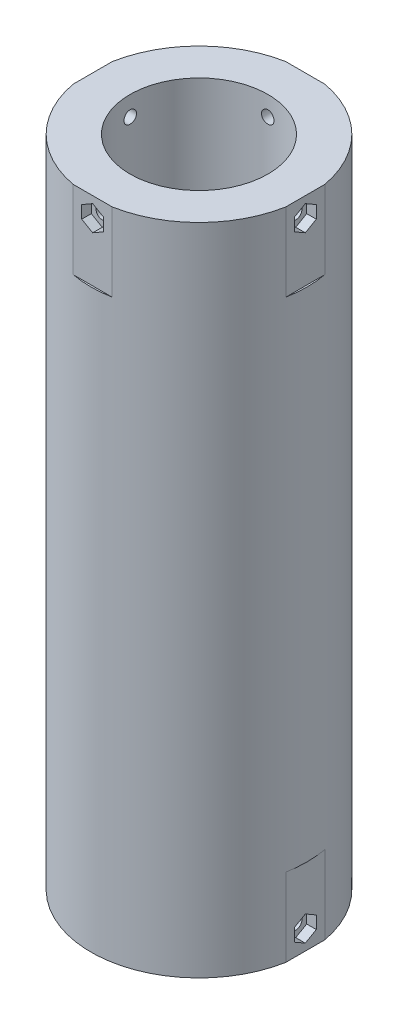
from build123d import *

# Parameters (mm, degrees)
SKETCH_1_R               = 27.65
SKETCH_1_R_2             = 17.65
EXTRUDE_1_DEPTH          = 167.37
CUT_EXTRUDE_1_DEPTH      = 20
CUT_EXTRUDE_START        = 147.37
CUT_EXTRUDE_2_DEPTH      = 20
CUT_EXTRUDE_4_DEPTH      = 26
CUT_EXTRUDE_4_DEPTH_BACK = 26
SKETCH_5_R               = 1.6
CUT_EXTRUDE_START_2      = 27.194163
CUT_EXTRUDE_3_DEPTH      = 2.45
CUT_EXTRUDE_5_DEPTH      = 2.45
CUT_EXTRUDE_START_3      = 27.2
CUT_EXTRUDE_6_DEPTH      = 2.45
PATTERN_CIRCULAR_2_COUNT = 4
SKETCH_8_R               = 1.6
CUT_EXTRUDE_7_DEPTH      = 32.4
PATTERN_CIRCULAR_3_COUNT = 4


with BuildPart() as part:
    # 草图1 → 凸台-拉伸1 (new body)
    with BuildSketch(Plane(origin=(0, 0, 0), x_dir=(1, 0, 0), z_dir=(0, 1, 0))):
        with Locations(Location((0, 0, 0), (0, 0, 270))):
            Circle(SKETCH_1_R)
        with Locations(Location((0, 0, 0), (0, 0, 270))):
            Circle(SKETCH_1_R_2, mode=Mode.SUBTRACT)
    extrude(amount=EXTRUDE_1_DEPTH)

    # 草图2 → 切除-拉伸1 (cut)
    with BuildSketch(Plane(origin=(0, 0, 0), x_dir=(1, 0, 0), z_dir=(0, 1, 0))):
        with BuildLine():
            Line((-27.194162977, 5), (-27.194162977, -5))
            ThreePointArc((-27.194162977, -5), (-27.65, 0), (-27.194162977, 5))
        make_face()
        with BuildLine():
            Line((27.194162977, -5), (27.194162977, 5))
            ThreePointArc((27.194162977, 5), (27.65, 0), (27.194162977, -5))
        make_face()
    extrude(amount=CUT_EXTRUDE_1_DEPTH, mode=Mode.SUBTRACT)

    # 草图3 → 切除-拉伸2 (cut)
    with BuildSketch(Plane(origin=(0, 0, 0), x_dir=(1, 0, 0), z_dir=(0, 1, 0)).offset(CUT_EXTRUDE_START)):
        with BuildLine():
            Line((-27.194162977, 5), (-27.194162977, -5))
            ThreePointArc((-27.194162977, -5), (-27.65, 0), (-27.194162977, 5))
        make_face()
        with BuildLine():
            Line((-5, -27.194162977), (5, -27.194162977))
            ThreePointArc((5, -27.194162977), (0, -27.65), (-5, -27.194162977))
        make_face()
        with BuildLine():
            Line((27.194162977, -5), (27.194162977, 5))
            ThreePointArc((27.194162977, 5), (27.65, 0), (27.194162977, -5))
        make_face()
        with BuildLine():
            Line((5, 27.194162977), (-5, 27.194162977))
            ThreePointArc((-5, 27.194162977), (0, 27.65), (5, 27.194162977))
        make_face()
    extrude(amount=CUT_EXTRUDE_2_DEPTH, mode=Mode.SUBTRACT)

    # 草图5 → 切除-拉伸4 (cut, two sides: drawn at the far end of the back side and taken through both)
    with BuildSketch(Plane.ZY.offset(-CUT_EXTRUDE_4_DEPTH_BACK)):
        with Locations((0, 5)):
            Circle(SKETCH_5_R)
    extrude(amount=CUT_EXTRUDE_4_DEPTH + CUT_EXTRUDE_4_DEPTH_BACK, mode=Mode.SUBTRACT)

    # 草图4 → 切除-拉伸3 (cut)
    with BuildSketch(Plane.ZY.offset(CUT_EXTRUDE_START_2)):
        Polygon((0, 8.233161507), (-2.8, 6.616580754), (-2.8, 3.383419246), (0, 1.766838493), (2.8, 3.383419246), (2.8, 6.616580754), align=None)
    extrude(amount=-CUT_EXTRUDE_3_DEPTH, mode=Mode.SUBTRACT)

    # 草图6 → 切除-拉伸5 (cut)
    with BuildSketch(Plane(origin=(0, 0, 0), x_dir=(0, 0, -1), z_dir=(1, 0, 0)).offset(CUT_EXTRUDE_START_2)):
        Polygon((0, 8.233161507), (-2.8, 6.616580754), (-2.8, 3.383419246), (0, 1.766838493), (2.8, 3.383419246), (2.8, 6.616580754), align=None)
    extrude(amount=-CUT_EXTRUDE_5_DEPTH, mode=Mode.SUBTRACT)

    # 草图7 → 切除-拉伸6 (cut)
    with BuildSketch(Plane(origin=(0, 0, 0), x_dir=(0, 0, -1), z_dir=(1, 0, 0)).offset(CUT_EXTRUDE_START_3)):
        Polygon((0, 165.603161507), (-2.8, 163.986580754), (-2.8, 160.753419246), (0, 159.136838493), (2.8, 160.753419246), (2.8, 163.986580754), align=None)
    cut_extrude_6 = extrude(amount=-CUT_EXTRUDE_6_DEPTH, mode=Mode.SUBTRACT)

    # 阵列(圆周)2: 切除-拉伸6 ×4 about axis
    pattern_circular_2_axis = Axis((0, 0, 0), (0, 1, 0))
    for i in range(1, PATTERN_CIRCULAR_2_COUNT):
        add(cut_extrude_6.rotate(pattern_circular_2_axis, i * 360 / PATTERN_CIRCULAR_2_COUNT), mode=Mode.SUBTRACT)

    # 草图8 → 切除-拉伸7 (cut)
    with BuildSketch(Plane(origin=(0, 0, 0), x_dir=(0, 0, -1), z_dir=(1, 0, 0))):
        with Locations(Location((0, 162.37, 0), (0, 0, 180))):
            Circle(SKETCH_8_R)
    cut_extrude_7 = extrude(amount=CUT_EXTRUDE_7_DEPTH, mode=Mode.SUBTRACT)

    # 阵列(圆周)3: 切除-拉伸7 ×4 about axis
    pattern_circular_3_axis = Axis((0, 167.37, 0), (0, -1, 0))
    for i in range(1, PATTERN_CIRCULAR_3_COUNT):
        add(cut_extrude_7.rotate(pattern_circular_3_axis, i * 360 / PATTERN_CIRCULAR_3_COUNT), mode=Mode.SUBTRACT)


solid = part.part
